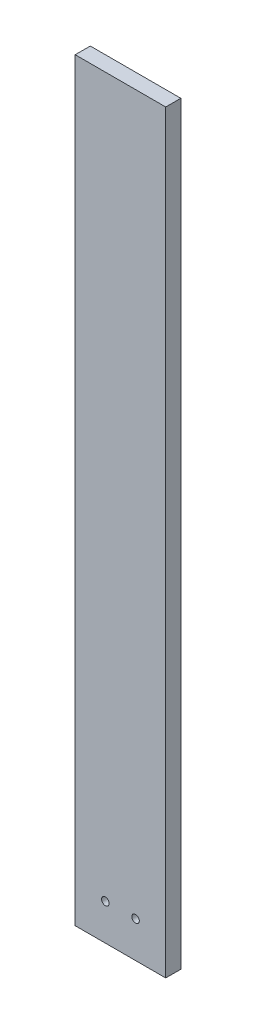
from build123d import *

# Parameters (mm, degrees)
SKETCH1_W           = 60
SKETCH1_H           = 500
BOSS_EXTRUDE1_DEPTH = 10
SKETCH2_R           = 2.5
CUT_EXTRUDE1_DEPTH  = 252.992063367


with BuildPart() as part:
    # Sketch1 → Boss-Extrude1 (new body)
    with BuildSketch(Plane.XY):
        Rectangle(SKETCH1_W, SKETCH1_H)
    extrude(amount=BOSS_EXTRUDE1_DEPTH)

    # Sketch2 → Cut-Extrude1 (cut, through all)
    with BuildSketch(Plane(origin=(0, 0, 0), x_dir=(-1, 0, 0), z_dir=(0, 0, -1))):
        with Locations((10, -226)):
            Circle(SKETCH2_R)
        with Locations(Location((-10, -226, 0), (0, 0, 180))):
            Circle(SKETCH2_R)
    extrude(amount=-CUT_EXTRUDE1_DEPTH, mode=Mode.SUBTRACT)


solid = part.part
